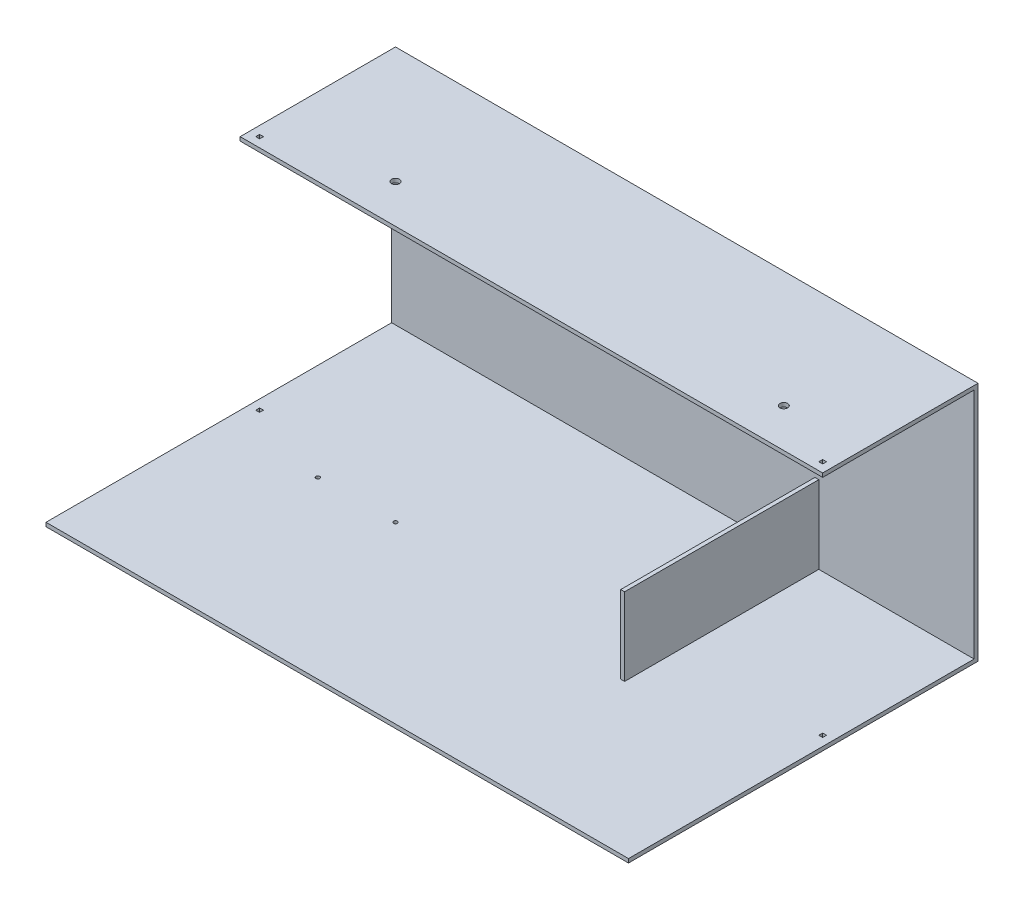
from build123d import *

# Parameters (mm, degrees)
SKETCH1_W               = 750
SKETCH1_H               = 450
BOSS_EXTRUDE1_DEPTH     = 310
SKETCH8_W               = 750
SKETCH8_H               = 300
CUT_EXTRUDE1_DEPTH      = 445
SKETCH15_W              = 5
SKETCH15_H              = 250
BOSS_EXTRUDE8_DEPTH     = 100
CUT_EXTRUDE2_DEPTH      = 537.050370768
CUT_EXTRUDE2_DEPTH_BACK = 10
SKETCH16_R              = 5
SKETCH16_W              = 750
SKETCH16_H              = 250
SKETCH18_W              = 5
SKETCH18_H              = 5
CUT_EXTRUDE3_DEPTH      = 537.050370768
SKETCH10_R              = 2.5
CUT_EXTRUDE4_DEPTH      = 534.174455502


with BuildPart() as part:
    # Sketch1 → Boss-Extrude1 (new body)
    with BuildSketch(Plane(origin=(0, 0, 0), x_dir=(1, 0, 0), z_dir=(0, 1, 0))):
        Rectangle(SKETCH1_W, SKETCH1_H)
    extrude(amount=BOSS_EXTRUDE1_DEPTH)

    # Sketch8 → Cut-Extrude1 (cut)
    with BuildSketch(Plane.XY.offset(225)):
        with Locations((0, 155)):
            Rectangle(SKETCH8_W, SKETCH8_H)
    extrude(amount=-CUT_EXTRUDE1_DEPTH, mode=Mode.SUBTRACT)

    # Sketch15 → Boss-Extrude8 (add)
    with BuildSketch(Plane(origin=(0, 5, 0), x_dir=(1, 0, 0), z_dir=(0, 1, 0))):
        with Locations((172.5, 95)):
            Rectangle(SKETCH15_W, SKETCH15_H)
    extrude(amount=BOSS_EXTRUDE8_DEPTH)

    # Sketch16 → Cut-Extrude2 (cut, two sides: drawn at the far end of the back side and taken through both)
    with BuildSketch(Plane(origin=(0, 310, 0), x_dir=(1, 0, 0), z_dir=(0, 1, 0)).offset(-CUT_EXTRUDE2_DEPTH_BACK)):
        with Locations(Location((275, 75, 0), (0, 0, 90))):
            Circle(SKETCH16_R)
        with Locations(Location((-225, 75, 0), (0, 0, 90))):
            Circle(SKETCH16_R)
        with Locations((0, -100)):
            Rectangle(SKETCH16_W, SKETCH16_H)
    extrude(amount=CUT_EXTRUDE2_DEPTH + CUT_EXTRUDE2_DEPTH_BACK, mode=Mode.SUBTRACT)

    # Sketch18 → Cut-Extrude3 (cut, through all)
    with BuildSketch(Plane(origin=(0, 310, 0), x_dir=(1, 0, 0), z_dir=(0, 1, 0))):
        with Locations((-362.5, 37.5)):
            Rectangle(SKETCH18_W, SKETCH18_H)
        with Locations((362.5, 37.5)):
            Rectangle(SKETCH18_W, SKETCH18_H)
    extrude(amount=-CUT_EXTRUDE3_DEPTH, mode=Mode.SUBTRACT)

    # Sketch10 → Cut-Extrude4 (cut, through all)
    with BuildSketch(Plane(origin=(0, 5, 0), x_dir=(1, 0, 0), z_dir=(0, 1, 0))):
        with Locations(Location((-250, 0, 0), (0, 0, 270))):
            Circle(SKETCH10_R)
        with Locations(Location((-150, 0, 0), (0, 0, 270))):
            Circle(SKETCH10_R)
    extrude(amount=-CUT_EXTRUDE4_DEPTH, mode=Mode.SUBTRACT)


solid = part.part
